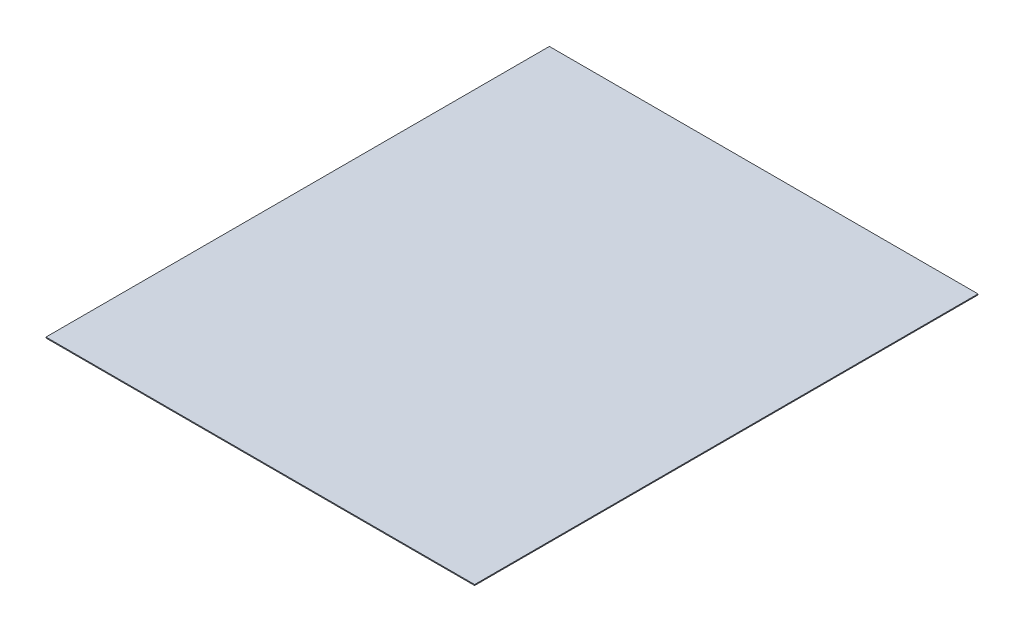
from build123d import *

# Parameters (mm, degrees)
SKETCH1_W            = 697
SKETCH1_H            = 1.5
OVEN_DIS_ALT_1_DEPTH = 818.5


with BuildPart() as part:
    # Sketch1 → OVEN_dis_alt_1 (new body)
    with BuildSketch(Plane.XY):
        with Locations((350, 120.75)):
            Rectangle(SKETCH1_W, SKETCH1_H)
    extrude(amount=-OVEN_DIS_ALT_1_DEPTH)


solid = part.part
